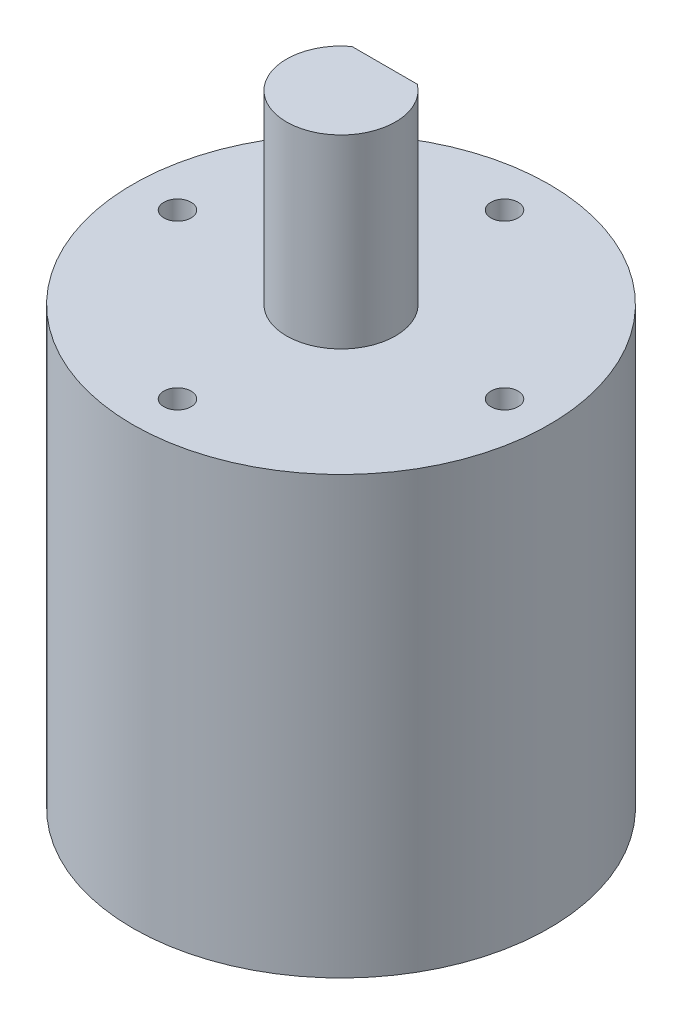
from build123d import *

# Parameters (mm, degrees)
SKETCH_1_R             = 19.1
EXTRUDE_1_DEPTH        = 40
SKETCH_2_R             = 5
EXTRUDE_2_DEPTH        = 17
CUT_EXTRUDE_START      = -15
CUT_EXTRUDE_1_DEPTH    = 15
HOLE_WIZARD_M3_1_D     = 2.5
HOLE_WIZARD_M3_1_DEPTH = 8.5
HOLE_WIZARD_M3_1_TIP   = 0.721687836


with BuildPart() as part:
    # 草图1 → 凸台-拉伸1 (new body)
    with BuildSketch(Plane(origin=(0, 0, 0), x_dir=(1, 0, 0), z_dir=(0, 1, 0))):
        with Locations(Location((0, 0, 0), (0, 0, 270))):
            Circle(SKETCH_1_R)
    extrude(amount=EXTRUDE_1_DEPTH)

    # 草图2 → 凸台-拉伸2 (add)
    with BuildSketch(Plane(origin=(0, 40, 0), x_dir=(1, 0, 0), z_dir=(0, 1, 0))):
        with Locations(Location((0, 0, 0), (0, 0, 270))):
            Circle(SKETCH_2_R)
    extrude(amount=EXTRUDE_2_DEPTH)

    # 草图3 → 切除-拉伸1 (cut)
    with BuildSketch(Plane(origin=(0, 57, 0), x_dir=(1, 0, 0), z_dir=(0, 1, 0)).offset(CUT_EXTRUDE_START)):
        with BuildLine():
            Line((-3, 4), (3, 4))
            ThreePointArc((3, 4), (0, 5), (-3, 4))
        make_face()
    extrude(amount=CUT_EXTRUDE_1_DEPTH, mode=Mode.SUBTRACT)

    # M3 螺纹孔1
    with Locations(Plane(origin=(0, 40, -15), x_dir=(0, 0, 1), z_dir=(0, 1, 0))):
        with Locations((0, 0), (15, -15), (15, 15), (30, 0)):
            Hole(HOLE_WIZARD_M3_1_D / 2, depth=HOLE_WIZARD_M3_1_DEPTH)
            with Locations((0, 0, -(HOLE_WIZARD_M3_1_DEPTH + HOLE_WIZARD_M3_1_TIP / 2))):  # 120° drill point
                Cone(0, HOLE_WIZARD_M3_1_D / 2, HOLE_WIZARD_M3_1_TIP, mode=Mode.SUBTRACT)


solid = part.part
